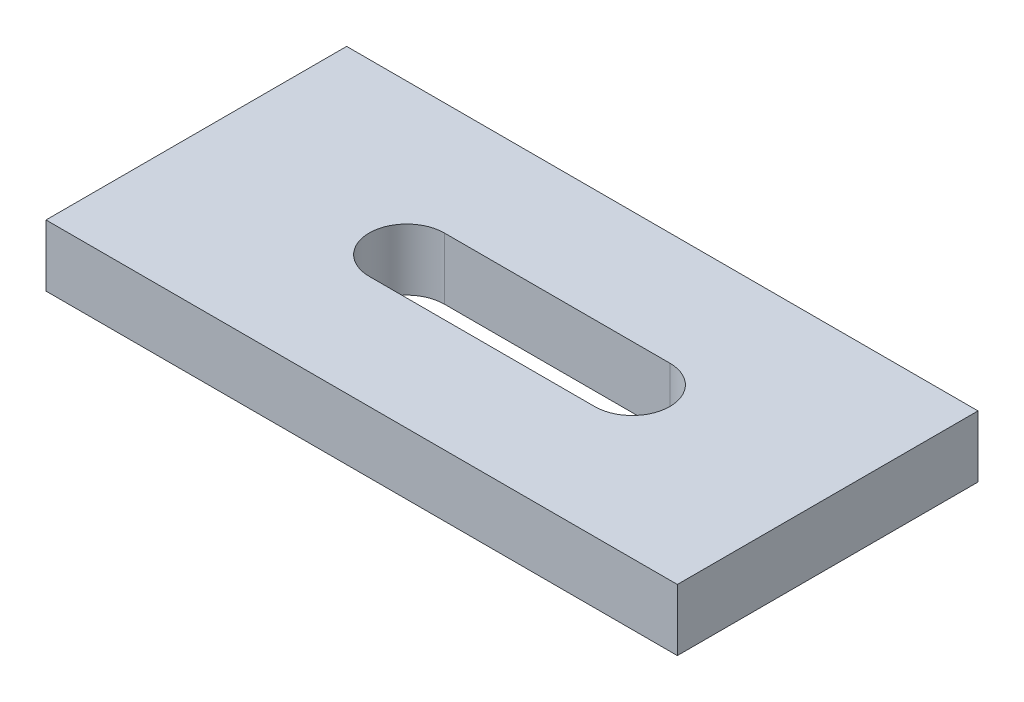
from build123d import *

# Parameters (mm, degrees)
SKETCH_1_W          = 42
SKETCH_1_H          = 20
EXTRUDE_1_DEPTH     = 4.1
CUT_EXTRUDE_1_DEPTH = 10


with BuildPart() as part:
    # 草图1 → 凸台-拉伸1 (new body)
    with BuildSketch(Plane(origin=(0, 0, 0), x_dir=(1, 0, 0), z_dir=(0, 1, 0))):
        with Locations((21, 10)):
            Rectangle(SKETCH_1_W, SKETCH_1_H)
    extrude(amount=EXTRUDE_1_DEPTH)

    # 草图2 → 切除-拉伸1 (cut)
    with BuildSketch(Plane(origin=(0, 4.1, 0), x_dir=(1, 0, 0), z_dir=(0, 1, 0))):
        with BuildLine():
            Line((14, 7.5), (29, 7.5))
            ThreePointArc((29, 7.5), (31.5, 10), (29, 12.5))
            Line((29, 12.5), (14, 12.5))
            ThreePointArc((14, 12.5), (11.5, 10), (14, 7.5))
        make_face()
    extrude(amount=-CUT_EXTRUDE_1_DEPTH, mode=Mode.SUBTRACT)


solid = part.part
